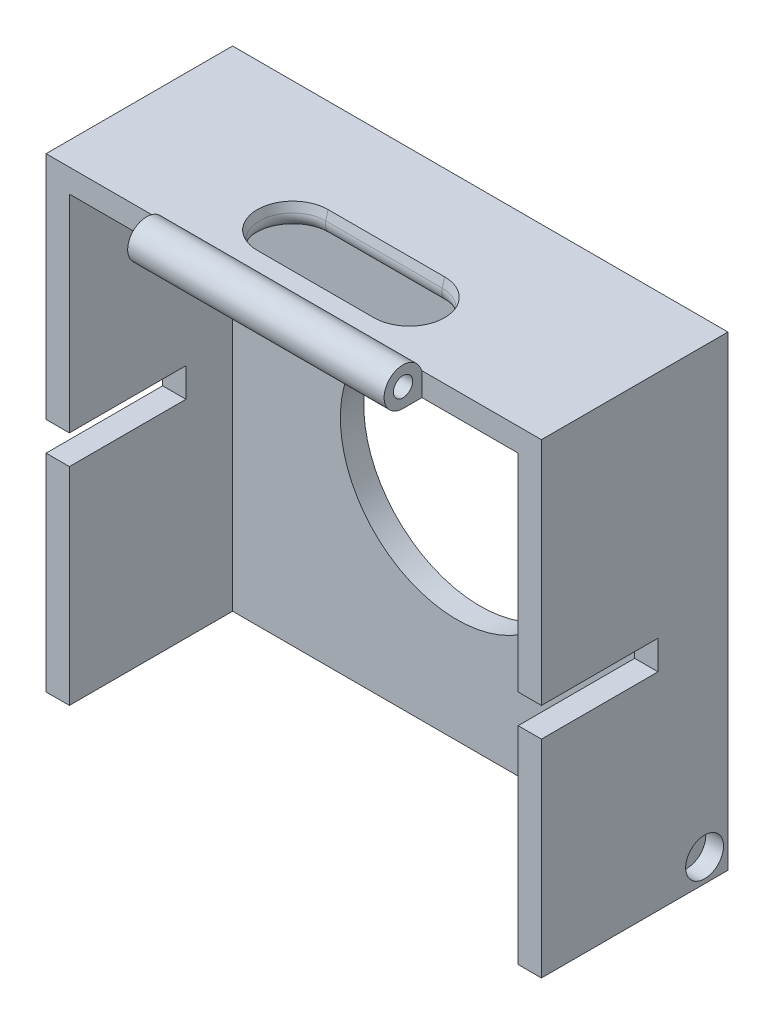
from build123d import *

# Parameters (mm, degrees)
SKETCH1_W                = 38.5
SKETCH1_H                = 38
SKETCH1_R                = 10
BOSS_EXTRUDE1_DEPTH      = 2
BOSS_EXTRUDE2_DEPTH      = 14
BOSS_EXTRUDE2_DEPTH_BACK = 2
CUT_EXTRUDE1_REACH       = 50.345
SKETCH3_W                = 10
SKETCH3_H                = 2.5
CUT_EXTRUDE2_DEPTH       = 47.384938288
CUT_EXTRUDE2_DRAFT       = 15
FILLET1_R                = 1
BOSS_EXTRUDE3_DEPTH      = 11
BOSS_EXTRUDE3_DEPTH_BACK = 11
SKETCH7_R                = 0.825
SKETCH8_R                = 1.625
CUT_EXTRUDE3_DEPTH       = 1.524


with BuildPart() as part:
    # Sketch1 → Boss-Extrude1 (new body)
    with BuildSketch(Plane.XY):
        Rectangle(SKETCH1_W, SKETCH1_H)
        Circle(SKETCH1_R, mode=Mode.SUBTRACT)
    extrude(amount=BOSS_EXTRUDE1_DEPTH)

    # Sketch2 → Boss-Extrude2 (add, two sides: drawn at the far end of the back side and taken through both)
    with BuildSketch(Plane.XY.offset(2).offset(-BOSS_EXTRUDE2_DEPTH_BACK)):
        Polygon((-21.25, -19), (-19.25, -19), (-19.25, 19), (19.25, 19), (19.25, -19), (21.25, -19), (21.25, 21), (-21.25, 21), align=None)
    extrude(amount=BOSS_EXTRUDE2_DEPTH + BOSS_EXTRUDE2_DEPTH_BACK)

    # Sketch3 → Cut-Extrude1 (cut, up to next)
    with BuildSketch(Plane(origin=(-19.25, 0, 0), x_dir=(0, 0, -1), z_dir=(1, 0, 0)), mode=Mode.PRIVATE) as cut_extrude1_sk1:
        with Locations((-11, 0)):
            Rectangle(SKETCH3_W, SKETCH3_H)
    cut_extrude1_tool1 = extrude(cut_extrude1_sk1.sketch, amount=-CUT_EXTRUDE1_REACH, mode=Mode.PRIVATE) & part.part
    cut_extrude1 = cut_extrude1_tool1.solids().sort_by_distance((-19.25, 0, 11))[0]
    add(cut_extrude1, mode=Mode.SUBTRACT)

    # Mirror1: Cut-Extrude1 across plane
    add(cut_extrude1.mirror(Plane(origin=(0, 0, 0), x_dir=(0, 0, 1), z_dir=(1, 0, 0))), mode=Mode.SUBTRACT)


with BuildPart() as cut_extrude2_tool:
    # Sketch5 → Cut-Extrude2 (with draft: the straight prism first)
    with BuildSketch(Plane.XZ.offset(-19)):
        with BuildLine():
            ThreePointArc((-5, 13.591034656), (-7.5, 11.091034656), (-5, 8.591034656))
            Line((-5, 8.591034656), (5, 8.591034656))
            ThreePointArc((5, 8.591034656), (7.5, 11.091034656), (5, 13.591034656))
            Line((5, 13.591034656), (-5, 13.591034656))
        make_face()
    extrude(amount=-CUT_EXTRUDE2_DEPTH)
    # Cut-Extrude2: the draft: its side faces are tilted about the plane it starts from
    cut_extrude2_sides = [cut_extrude2_tool.faces().sort_by_distance(p)[0] for p in [
        (0, 42.692469144, 13.591034656),
        (-7.5, 42.692469144, 11.091034656),
        (0, 42.692469144, 8.591034656),
        (7.5, 42.692469144, 11.091034656),
    ]]
    draft(cut_extrude2_sides, Plane.XZ.offset(-19), CUT_EXTRUDE2_DRAFT)


with BuildPart() as part_1:
    add(part.part)

    # Cut-Extrude2: cut by cut_extrude2_tool
    add(cut_extrude2_tool.part, mode=Mode.SUBTRACT)

    # Fillet1
    fillet1_edges = [part_1.edges().sort_by_distance(p)[0] for p in [
        (-7.5, 19, 11.091034656),
        (0, 19, 8.591034656),
        (7.5, 19, 11.091034656),
        (0, 19, 13.591034656),
    ]]
    fillet(fillet1_edges, radius=FILLET1_R)

    # Sketch7 → Boss-Extrude3 (add, two sides: drawn at the far end of the back side and taken through both)
    with BuildSketch(Plane(origin=(0, 0, 0), x_dir=(0, 0, -1), z_dir=(1, 0, 0)).offset(-BOSS_EXTRUDE3_DEPTH_BACK)):
        with BuildLine():
            Line((-17.625, 19), (-16, 19))
            Line((-16, 19), (-16, 21))
            ThreePointArc((-16, 21), (-16.073732036, 21.14399831), (-16.142494793, 21.290434678))
            ThreePointArc((-16.142494793, 21.290434678), (-18.989176739, 21.507976118), (-17.625, 19))
        make_face()
        with Locations((-17.625, 20.625)):
            Circle(SKETCH7_R, mode=Mode.SUBTRACT)
    extrude(amount=BOSS_EXTRUDE3_DEPTH + BOSS_EXTRUDE3_DEPTH_BACK)

    # Sketch8 → Cut-Extrude3 (cut)
    with BuildSketch(Plane(origin=(21.25, 0, 0), x_dir=(0, 0, -1), z_dir=(1, 0, 0))):
        with Locations(Location((-2, -17, 0), (0, 0, 90))):
            Circle(SKETCH8_R)
    cut_extrude3 = extrude(amount=-CUT_EXTRUDE3_DEPTH, mode=Mode.SUBTRACT)

    # Mirror2: Cut-Extrude3 across plane
    add(cut_extrude3.mirror(Plane(origin=(0, 0, 0), x_dir=(0, 0, 1), z_dir=(1, 0, 0))), mode=Mode.SUBTRACT)


solid = part_1.part
